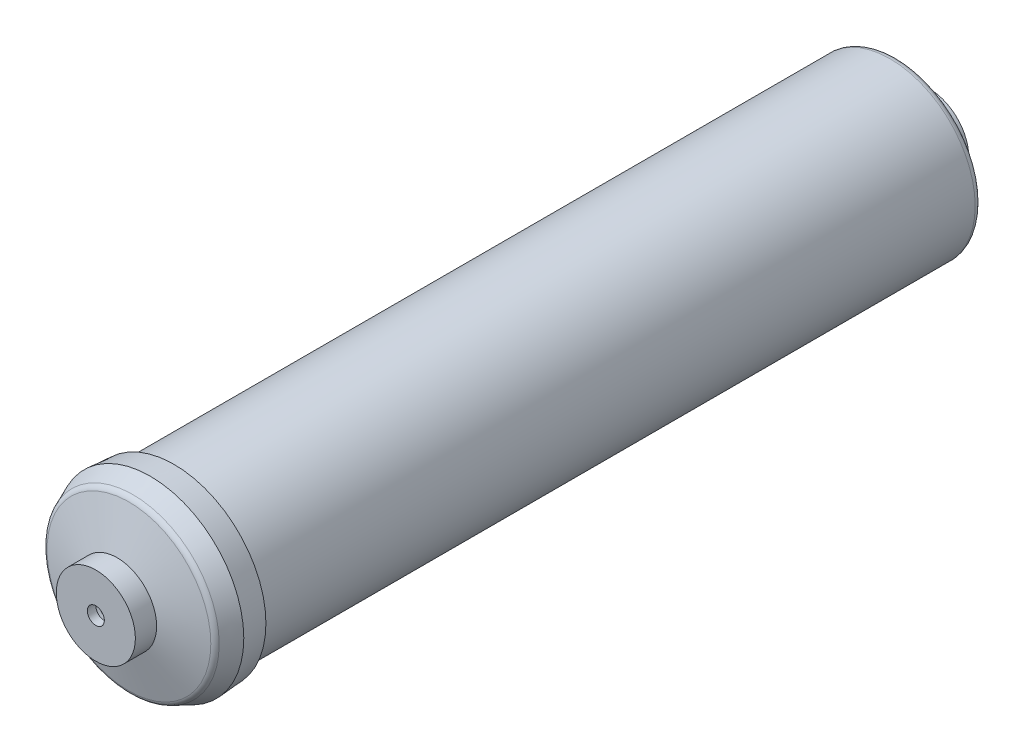
from build123d import *

# Parameters (mm, degrees)
FILLET1_R = 2.54


with BuildPart() as part:
    # Sketch1 → Revolve1 (revolve)
    with BuildSketch(Plane(origin=(0, 0, 0), x_dir=(0, 0, -1), z_dir=(1, 0, 0)), mode=Mode.PRIVATE) as revolve1_sk:
        Polygon((0, 14.76375), (7.9375, 14.76375), (12.7, 31.75), (20.32, 34.925), (29.21, 34.29), (29.21, 31.75), (298.45, 31.75), (303.2125, 14.76375), (311.15, 14.76375), (311.15, 3.175), (307.975, 3.175), (307.975, 11.58875), (300.805254923, 11.58875), (296.042754923, 28.575), (26.035, 28.575), (26.035, 31.333696529), (20.845500206, 31.704375086), (15.341669029, 29.411112095), (10.344745077, 11.58875), (3.175, 11.58875), (3.175, 3.175), (0, 3.175), align=None)
    revolve(revolve1_sk.sketch.rotate(Axis((0, 0, 0), (0, 0, -1)), 90), axis=Axis((0, 0, 0), (0, 0, -1)))

    # Fillet1
    fillet1_edges = [part.edges().sort_by_distance(p)[0] for p in [
        (-31.75, 0, -298.45),
        (-31.75, 0, -12.7),
    ]]
    fillet(fillet1_edges, radius=FILLET1_R)


solid = part.part
